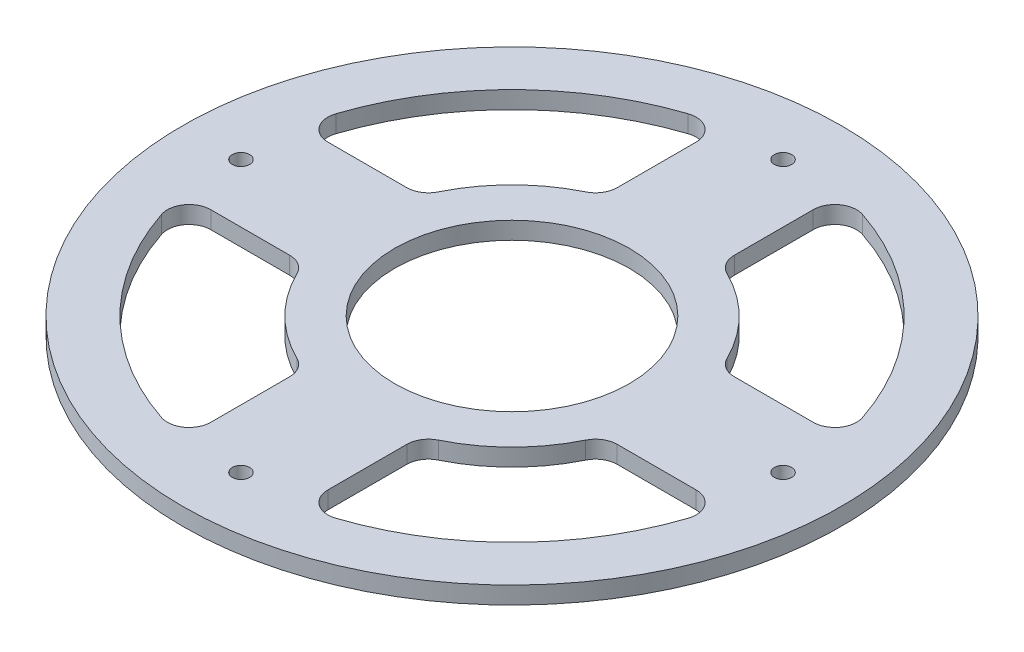
from build123d import *

# Parameters (mm, degrees)
BOSS_EXTRUDE1_DEPTH      = 2
BOSS_EXTRUDE1_DEPTH_BACK = 2
SKETCH1_R                = 76
SKETCH1_R_2              = 27.051
SKETCH1_R_3              = 2
CUT_EXTRUDE2_DEPTH       = 108.554637278
FILLET1_R                = 5


with BuildPart() as part:
    # Sketch1 → Boss-Extrude1 (new, two sides: drawn at the far end of the back side and taken through both)
    with BuildSketch(Plane(origin=(0, 0, 0), x_dir=(1, 0, 0), z_dir=(0, 1, 0)).offset(-BOSS_EXTRUDE1_DEPTH_BACK)):
        Circle(SKETCH1_R)
        Circle(SKETCH1_R_2, mode=Mode.SUBTRACT)
        with Locations((0, 62.5)):
            Circle(SKETCH1_R_3, mode=Mode.SUBTRACT)
        with Locations((62.5, 0)):
            Circle(SKETCH1_R_3, mode=Mode.SUBTRACT)
        with Locations((0, -62.5)):
            Circle(SKETCH1_R_3, mode=Mode.SUBTRACT)
        with Locations((-62.5, 0)):
            Circle(SKETCH1_R_3, mode=Mode.SUBTRACT)
    extrude(amount=BOSS_EXTRUDE1_DEPTH + BOSS_EXTRUDE1_DEPTH_BACK)

    # Sketch4 → Cut-Extrude2 (cut, through all)
    with BuildSketch(Plane(origin=(0, 2, 0), x_dir=(1, 0, 0), z_dir=(0, 1, 0))):
        with BuildLine():
            ThreePointArc((62.5, 13.5), (45.213382975, 45.213382975), (13.5, 62.5))
            Line((13.5, 62.5), (13.5, 34.504008477))
            ThreePointArc((13.5, 34.504008477), (26.19901335, 26.19901335), (34.504008477, 13.5))
            Line((34.504008477, 13.5), (62.5, 13.5))
        make_face()
        with BuildLine():
            ThreePointArc((-34.504008477, 13.5), (-26.19901335, 26.19901335), (-13.5, 34.504008477))
            Line((-13.5, 34.504008477), (-13.5, 62.5))
            ThreePointArc((-13.5, 62.5), (-45.213382975, 45.213382975), (-62.5, 13.5))
            Line((-62.5, 13.5), (-34.504008477, 13.5))
        make_face()
        with BuildLine():
            Line((62.5, -13.5), (34.504008477, -13.5))
            ThreePointArc((34.504008477, -13.5), (26.19901335, -26.19901335), (13.5, -34.504008477))
            Line((13.5, -34.504008477), (13.5, -62.5))
            ThreePointArc((13.5, -62.5), (45.213382975, -45.213382975), (62.5, -13.5))
        make_face()
        with BuildLine():
            ThreePointArc((-13.5, -34.504008477), (-26.19901335, -26.19901335), (-34.504008477, -13.5))
            Line((-34.504008477, -13.5), (-62.5, -13.5))
            ThreePointArc((-62.5, -13.5), (-45.213382975, -45.213382975), (-13.5, -62.5))
            Line((-13.5, -62.5), (-13.5, -34.504008477))
        make_face()
    extrude(amount=-CUT_EXTRUDE2_DEPTH, mode=Mode.SUBTRACT)

    # Fillet1
    fillet1_edges = [part.edges().sort_by_distance(p)[0] for p in [
        (-13.5, 0, 34.504008477),
        (-13.5, 0, 62.5),
        (-34.504008477, 0, 13.5),
        (-62.5, 0, 13.5),
        (13.5, 0, 62.5),
        (13.5, 0, 34.504008477),
        (34.504008477, 0, 13.5),
        (62.5, 0, 13.5),
        (34.504008477, 0, -13.5),
        (13.5, 0, -34.504008477),
        (62.5, 0, -13.5),
        (13.5, 0, -62.5),
        (-62.5, 0, -13.5),
        (-34.504008477, 0, -13.5),
        (-13.5, 0, -34.504008477),
        (-13.5, 0, -62.5),
    ]]
    fillet(fillet1_edges, radius=FILLET1_R)


solid = part.part
